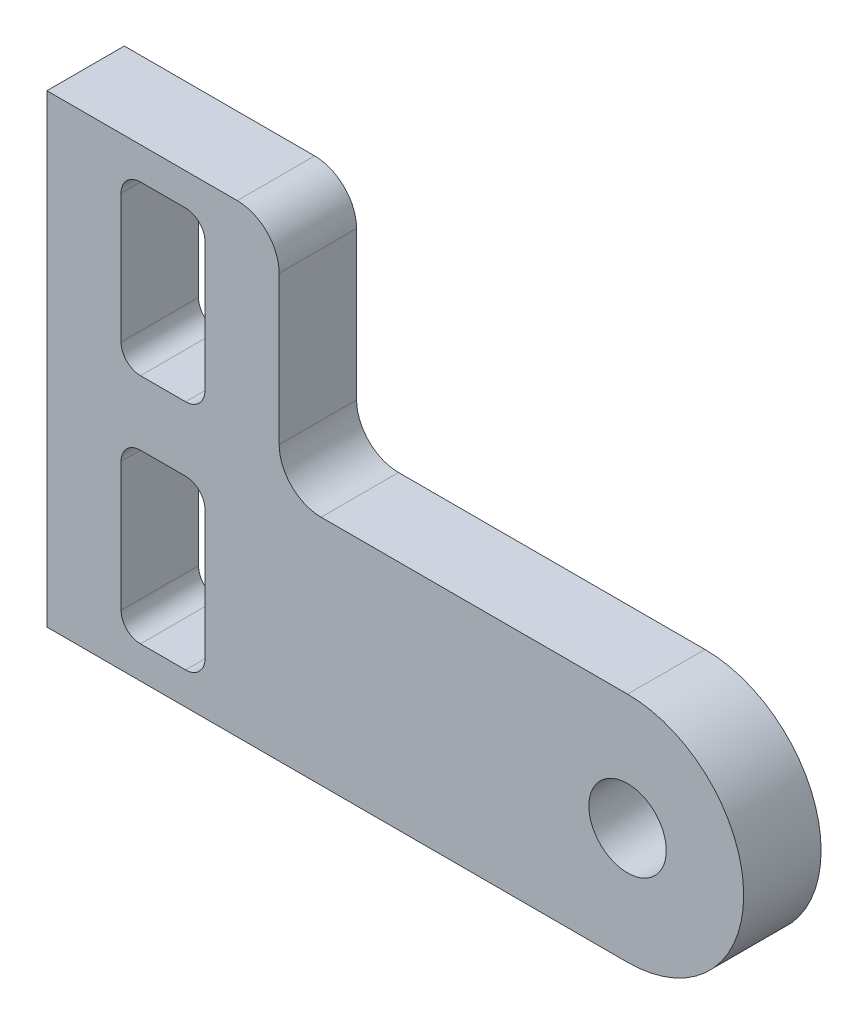
from build123d import *

# Parameters (mm, degrees)
MODEL_R                 = 1.5
SALIENTE_EXTRUIR1_DEPTH = 3


with BuildPart() as part:
    # Model → Saliente-Extruir1 (new body)
    with BuildSketch(Plane.XY):
        with BuildLine():
            Line((185.972853309, 282.646547335), (178.597853309, 282.646547335))
            Line((178.597853309, 282.646547335), (178.597853309, 264.646547335))
            Line((178.597853309, 264.646547335), (201.097853309, 264.646547335))
            ThreePointArc((201.097853309, 264.646547335), (205.597853309, 269.146547335), (201.097853309, 273.646547335))
            Line((201.097853309, 273.646547335), (189.222853309, 273.646547335))
            ThreePointArc((189.222853309, 273.646547335), (188.07380479, 274.122498816), (187.597853309, 275.271547335))
            Line((187.597853309, 275.271547335), (187.597853309, 281.021547335))
            ThreePointArc((187.597853309, 281.021547335), (187.121901829, 282.170595855), (185.972853309, 282.646547335))
        make_face()
        with Locations((201.097853309, 269.146547335)):
            Circle(MODEL_R, mode=Mode.SUBTRACT)
        with BuildLine():
            Line((182.222853309, 265.896547335), (183.972853309, 265.896547335))
            ThreePointArc((183.972853309, 265.896547335), (184.503183395, 266.116217249), (184.722853309, 266.646547335))
            Line((184.722853309, 266.646547335), (184.722853309, 271.646547335))
            ThreePointArc((184.722853309, 271.646547335), (184.503183395, 272.176877421), (183.972853309, 272.396547335))
            Line((183.972853309, 272.396547335), (182.222853309, 272.396547335))
            ThreePointArc((182.222853309, 272.396547335), (181.692523223, 272.176877421), (181.472853309, 271.646547335))
            Line((181.472853309, 271.646547335), (181.472853309, 266.646547335))
            ThreePointArc((181.472853309, 266.646547335), (181.692523223, 266.116217249), (182.222853309, 265.896547335))
        make_face(mode=Mode.SUBTRACT)
        with BuildLine():
            Line((182.222853309, 274.895968764), (183.972853309, 274.895968764))
            ThreePointArc((183.972853309, 274.895968764), (184.503183395, 275.115638678), (184.722853309, 275.645968764))
            Line((184.722853309, 275.645968764), (184.722853309, 280.645968764))
            ThreePointArc((184.722853309, 280.645968764), (184.503183395, 281.17629885), (183.972853309, 281.395968764))
            Line((183.972853309, 281.395968764), (182.222853309, 281.395968764))
            ThreePointArc((182.222853309, 281.395968764), (181.692523223, 281.17629885), (181.472853309, 280.645968764))
            Line((181.472853309, 280.645968764), (181.472853309, 275.645968764))
            ThreePointArc((181.472853309, 275.645968764), (181.692523223, 275.115638678), (182.222853309, 274.895968764))
        make_face(mode=Mode.SUBTRACT)
    extrude(amount=SALIENTE_EXTRUIR1_DEPTH)


solid = part.part
